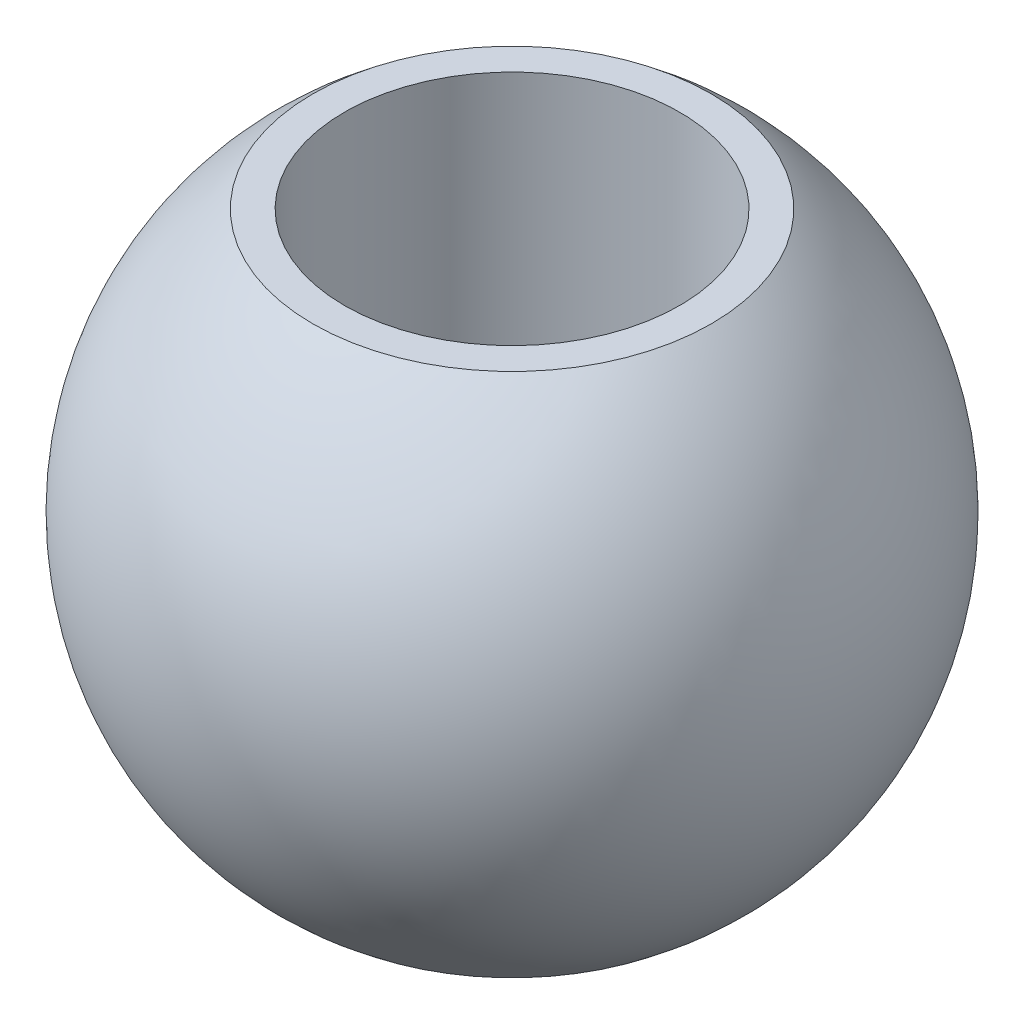
from build123d import *

# Parameters (mm, degrees)
SKETCH3_R          = 1.5
CUT_EXTRUDE1_DEPTH = 4.7


with BuildPart() as part:
    # Sketch2 → Revolve1 (revolve)
    with BuildSketch(Plane.XY):
        with BuildLine():
            Line((0, 2.35), (0, -2.35))
            Line((0, -2.35), (1.78325545, -2.35))
            ThreePointArc((1.78325545, -2.35), (2.95, 0), (1.78325545, 2.35))
            Line((1.78325545, 2.35), (0, 2.35))
        make_face()
    revolve(axis=Axis((0, 2.35, 0), (0, -1, 0)))

    # Sketch3 → Cut-Extrude1 (cut)
    with BuildSketch(Plane(origin=(0, 2.35, 0), x_dir=(1, 0, 0), z_dir=(0, 1, 0))):
        with Locations(Location((0, 0, 0), (0, 0, 270))):
            Circle(SKETCH3_R)
    extrude(amount=-CUT_EXTRUDE1_DEPTH, mode=Mode.SUBTRACT)


solid = part.part
